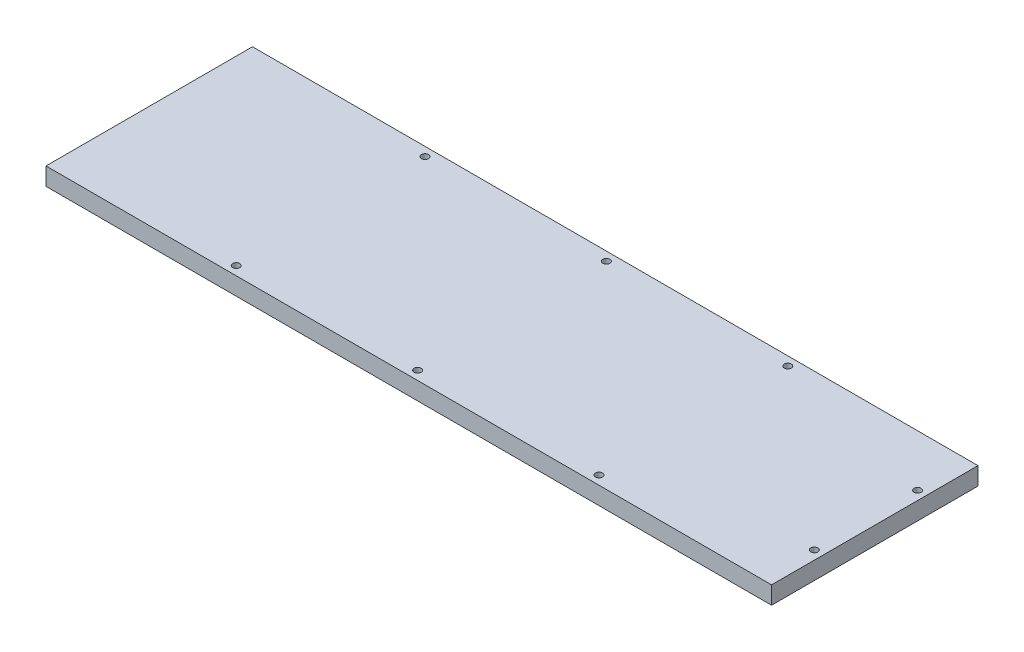
from build123d import *

# Parameters (mm, degrees)
SKETCH_1_W          = 123
SKETCH_1_H          = 35
EXTRUDE_1_DEPTH     = 3
SKETCH_2_R          = 0.6
CUT_EXTRUDE_1_DEPTH = 65.011717677
SKETCH_2_3_R        = 1
CUT_EXTRUDE_2_DEPTH = 1.5
SKETCH_3_W          = 3
SKETCH_3_H          = 3
CUT_EXTRUDE_3_DEPTH = 2


with BuildPart() as part:
    # 草图1 → 凸台-拉伸1 (new body)
    with BuildSketch(Plane(origin=(0, 0, 0), x_dir=(1, 0, 0), z_dir=(0, 1, 0))):
        Rectangle(SKETCH_1_W, SKETCH_1_H)
    extrude(amount=EXTRUDE_1_DEPTH)

    # 草图2 → 切除-拉伸1 (cut, through all)
    with BuildSketch(Plane.XZ):
        with Locations((-30.75, 16)):
            Circle(SKETCH_2_R)
        with Locations((30.75, 16)):
            Circle(SKETCH_2_R)
        with Locations((-30.75, -16)):
            Circle(SKETCH_2_R)
        with Locations((30.75, -16)):
            Circle(SKETCH_2_R)
        with Locations((0, 16)):
            Circle(SKETCH_2_R)
        with Locations((0, -16)):
            Circle(SKETCH_2_R)
        with Locations((60, 8.75)):
            Circle(SKETCH_2_R)
        with Locations((60, -8.75)):
            Circle(SKETCH_2_R)
    extrude(amount=-CUT_EXTRUDE_1_DEPTH, mode=Mode.SUBTRACT)

    # 草图2<3> → 切除-拉伸2 (cut)
    with BuildSketch(Plane.XZ):
        with Locations((-30.75, 16)):
            Circle(SKETCH_2_3_R)
        with Locations((30.75, 16)):
            Circle(SKETCH_2_3_R)
        with Locations((-30.75, -16)):
            Circle(SKETCH_2_3_R)
        with Locations((30.75, -16)):
            Circle(SKETCH_2_3_R)
        with Locations((0, 16)):
            Circle(SKETCH_2_3_R)
        with Locations((0, -16)):
            Circle(SKETCH_2_3_R)
        with Locations((60, 8.75)):
            Circle(SKETCH_2_3_R)
        with Locations((60, -8.75)):
            Circle(SKETCH_2_3_R)
    extrude(amount=-CUT_EXTRUDE_2_DEPTH, mode=Mode.SUBTRACT)

    # 草图3 → 切除-拉伸3 (cut)
    with BuildSketch(Plane.XZ):
        with Locations((58.5, -14.5)):
            Rectangle(SKETCH_3_W, SKETCH_3_H)
        with Locations((58.5, 14.5)):
            Rectangle(SKETCH_3_W, SKETCH_3_H)
        with Locations((58.5, 0)):
            Rectangle(SKETCH_3_W, SKETCH_3_H)
        with Locations((36.9, 14.5)):
            Rectangle(SKETCH_3_W, SKETCH_3_H)
        with Locations((12.3, 14.5)):
            Rectangle(SKETCH_3_W, SKETCH_3_H)
        with Locations((-12.3, 14.5)):
            Rectangle(SKETCH_3_W, SKETCH_3_H)
        with Locations((-36.9, 14.5)):
            Rectangle(SKETCH_3_W, SKETCH_3_H)
        with Locations((36.9, -14.5)):
            Rectangle(SKETCH_3_W, SKETCH_3_H)
        with Locations((36.896881316, -95.946698649)):
            Rectangle(SKETCH_3_W, SKETCH_3_H)
        with Locations((12.3, -14.5)):
            Rectangle(SKETCH_3_W, SKETCH_3_H)
        with Locations((-12.3, -14.5)):
            Rectangle(SKETCH_3_W, SKETCH_3_H)
        with Locations((-36.9, -14.5)):
            Rectangle(SKETCH_3_W, SKETCH_3_H)
    extrude(amount=-CUT_EXTRUDE_3_DEPTH, mode=Mode.SUBTRACT)


solid = part.part
